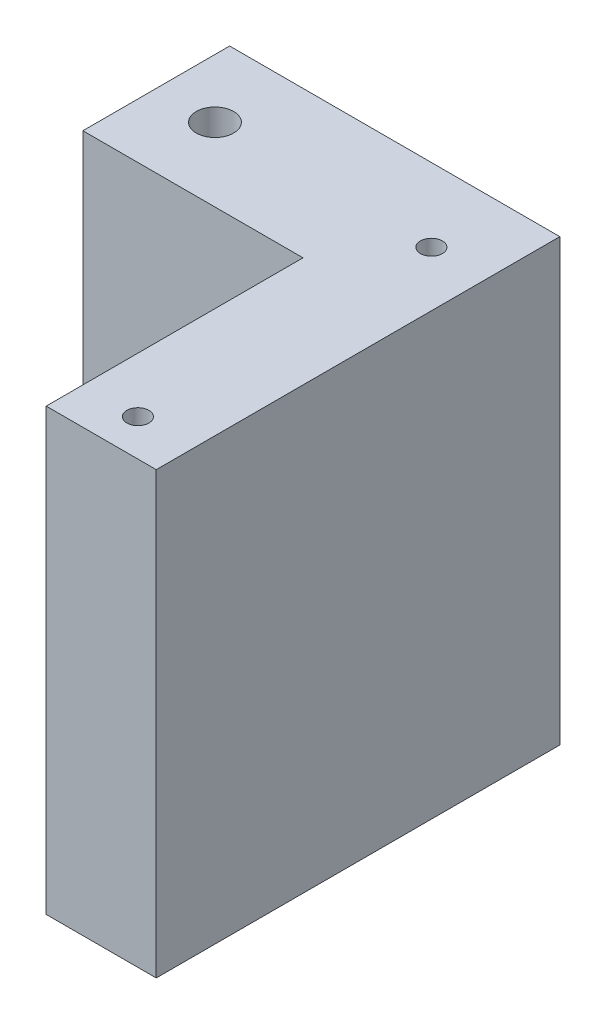
from build123d import *

# Parameters (mm, degrees)
SKETCH1_W           = 15
SKETCH1_H           = 55
SKETCH1_R           = 1.5
SKETCH1_W_2         = 30
SKETCH1_H_2         = 20
SKETCH1_R_2         = 2.55
BOSS_EXTRUDE1_DEPTH = 60
SKETCH2_R           = 2.5
CUT_EXTRUDE1_DEPTH  = 20


with BuildPart() as part:
    # Sketch1 → Boss-Extrude1 (new body)
    # profile 1 of 2: a face of its own
    with BuildSketch(Plane(origin=(0, 0, 0), x_dir=(1, 0, 0), z_dir=(0, 1, 0))):
        Rectangle(SKETCH1_W, SKETCH1_H)
        with Locations(Location((0, -22.5, 0), (0, 0, 270))):
            Circle(SKETCH1_R, mode=Mode.SUBTRACT)
        with Locations(Location((0, 17.5, 0), (0, 0, 270))):
            Circle(SKETCH1_R, mode=Mode.SUBTRACT)
    # profile 2 of 2: a face of its own
    with BuildSketch(Plane(origin=(0, 0, 0), x_dir=(1, 0, 0), z_dir=(0, 1, 0))):
        with Locations((-22.5, 17.5)):
            Rectangle(SKETCH1_W_2, SKETCH1_H_2)
        with Locations(Location((-29.5, 17.5, 0), (0, 0, 270))):
            Circle(SKETCH1_R_2, mode=Mode.SUBTRACT)
    extrude(amount=BOSS_EXTRUDE1_DEPTH)

    # Sketch2 → Cut-Extrude1 (cut)
    with BuildSketch(Plane(origin=(0, 0, -27.5), x_dir=(-1, 0, 0), z_dir=(0, 0, -1))):
        with Locations((22.5, 5)):
            Circle(SKETCH2_R)
    extrude(amount=-CUT_EXTRUDE1_DEPTH, mode=Mode.SUBTRACT)


solid = part.part
